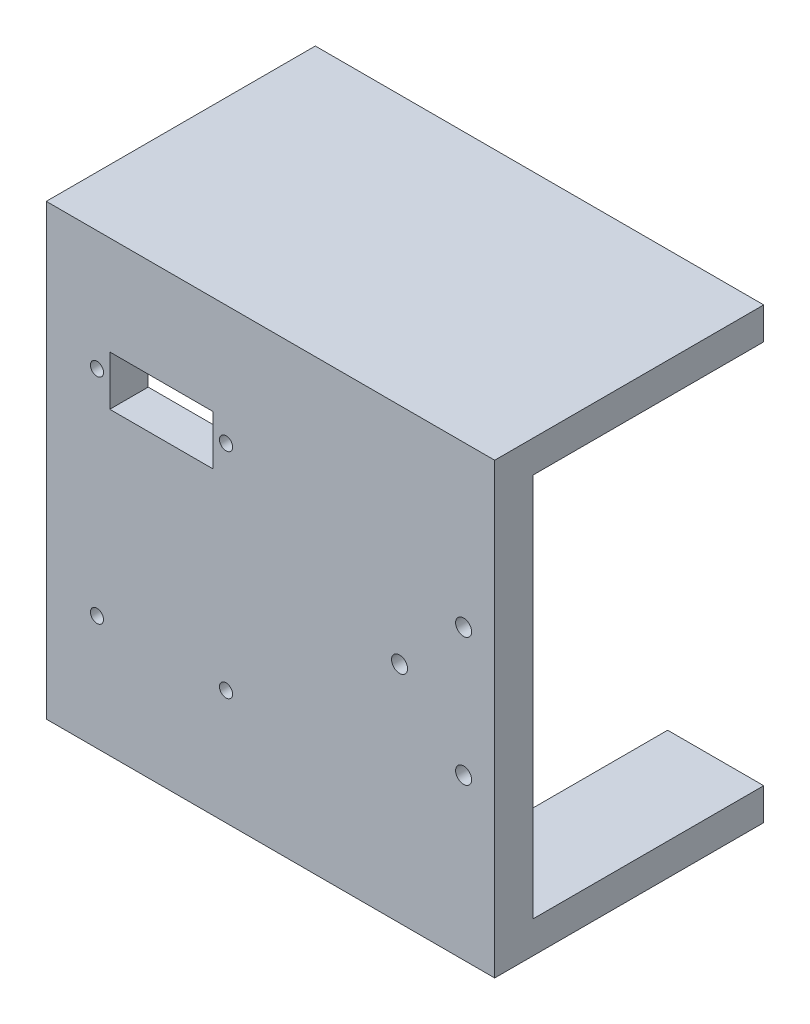
from build123d import *

# Parameters (mm, degrees)
SKETCH1_W             = 70
SKETCH1_H             = 5
BOSS_EXTRUDE1_DEPTH   = 36
SKETCH1_W_2           = 15
BOSS_EXTRUDE1_2_DEPTH = 36
SKETCH2_W             = 6
SKETCH2_H             = 70
BOSS_EXTRUDE2_DEPTH   = 70
M2_TAPPED_HOLE1_D     = 1.6
M2_TAPPED_HOLE1_DEPTH = 5
M2_TAPPED_HOLE1_TIP   = 0.480688495
M3_TAPPED_HOLE1_D     = 2.5
M2_5_TAPPED_HOLE1_D   = 2.05
SKETCH10_W            = 16.15
SKETCH10_H            = 7.752972879
CUT_EXTRUDE1_DEPTH    = 10


with BuildPart() as part:
    # Sketch1 → Boss-Extrude1 (new body)
    with BuildSketch(Plane.XY):
        with Locations((-4.38247012, 44.37250996)):
            Rectangle(SKETCH1_W, SKETCH1_H)
    extrude(amount=BOSS_EXTRUDE1_DEPTH)



with BuildPart() as body_2:
    # Sketch1 → Boss-Extrude1 2 (new body)
    with BuildSketch(Plane.XY):
        with Locations((23.11752988, -20.62749004)):
            Rectangle(SKETCH1_W_2, SKETCH1_H)
    extrude(amount=BOSS_EXTRUDE1_2_DEPTH)


with BuildPart() as part_1:
    add(part.part)

    add(body_2.part)  # Boss-Extrude2 merges body 2
    # Sketch2 → Boss-Extrude2 (add)
    with BuildSketch(Plane(origin=(30.61752988, 0, 0), x_dir=(0, 0, -1), z_dir=(1, 0, 0))):
        with Locations((-39, 11.87250996)):
            Rectangle(SKETCH2_W, SKETCH2_H)
    extrude(amount=-BOSS_EXTRUDE2_DEPTH)

    # M2 Tapped Hole1
    with Locations(Plane(origin=(23.61752988, 44.37250996, 0), x_dir=(-1, 0, 0), z_dir=(0, 0, -1))):
        with Locations((0, 0), (56, 0), (0, -65)):
            Hole(M2_TAPPED_HOLE1_D / 2, depth=M2_TAPPED_HOLE1_DEPTH)
            with Locations((0, 0, -(M2_TAPPED_HOLE1_DEPTH + M2_TAPPED_HOLE1_TIP / 2))):  # 118° drill point
                Cone(0, M2_TAPPED_HOLE1_D / 2, M2_TAPPED_HOLE1_TIP, mode=Mode.SUBTRACT)

    # M3 Tapped Hole1 (through all)
    with Locations(Plane(origin=(15.767468025, 11.87250996, 42), x_dir=(0, 1, 0), z_dir=(0, 0, 1))):
        with Locations((0, 0), (-10, -10), (10, -10)):
            Hole(M3_TAPPED_HOLE1_D / 2)

    # M2.5 Tapped Hole1 (through all)
    with Locations(Plane(origin=(-31.46932371, 28.191052792, 42), x_dir=(0, 1, 0), z_dir=(0, 0, 1))):
        with Locations((0, 0), (0, -20.15), (-33.4, -20.15), (-33.4, 0)):
            Hole(M2_5_TAPPED_HOLE1_D / 2)

    # Sketch10 → Cut-Extrude1 (cut)
    with BuildSketch(Plane.XY.offset(42)):
        with Locations((-21.39432371, 27.591449479)):
            Rectangle(SKETCH10_W, SKETCH10_H)
    extrude(amount=-CUT_EXTRUDE1_DEPTH, mode=Mode.SUBTRACT)


solid = part_1.part
